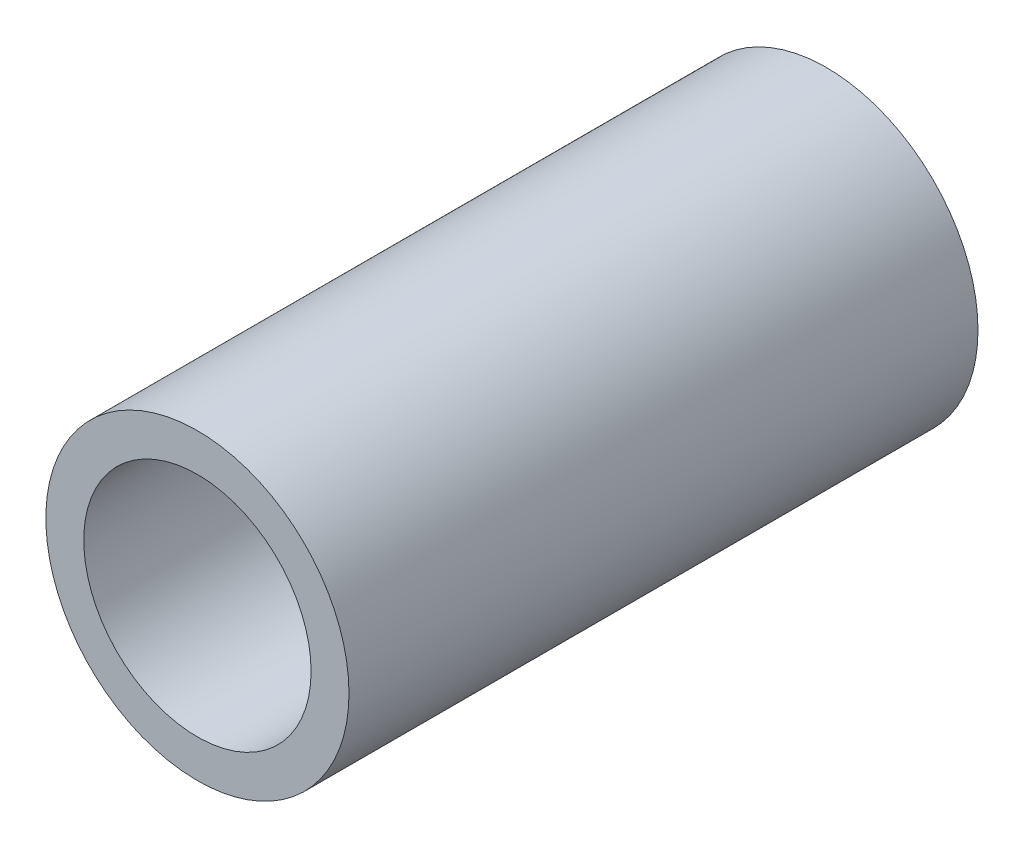
from build123d import *

# Parameters (mm, degrees)
CROQUIS1_R              = 20
CROQUIS1_R_2            = 15
SALIENTE_EXTRUIR1_DEPTH = 83


with BuildPart() as part:
    # Croquis1 → Saliente-Extruir1 (new body)
    with BuildSketch(Plane.XY):
        Circle(CROQUIS1_R)
        Circle(CROQUIS1_R_2, mode=Mode.SUBTRACT)
    extrude(amount=SALIENTE_EXTRUIR1_DEPTH)


solid = part.part
